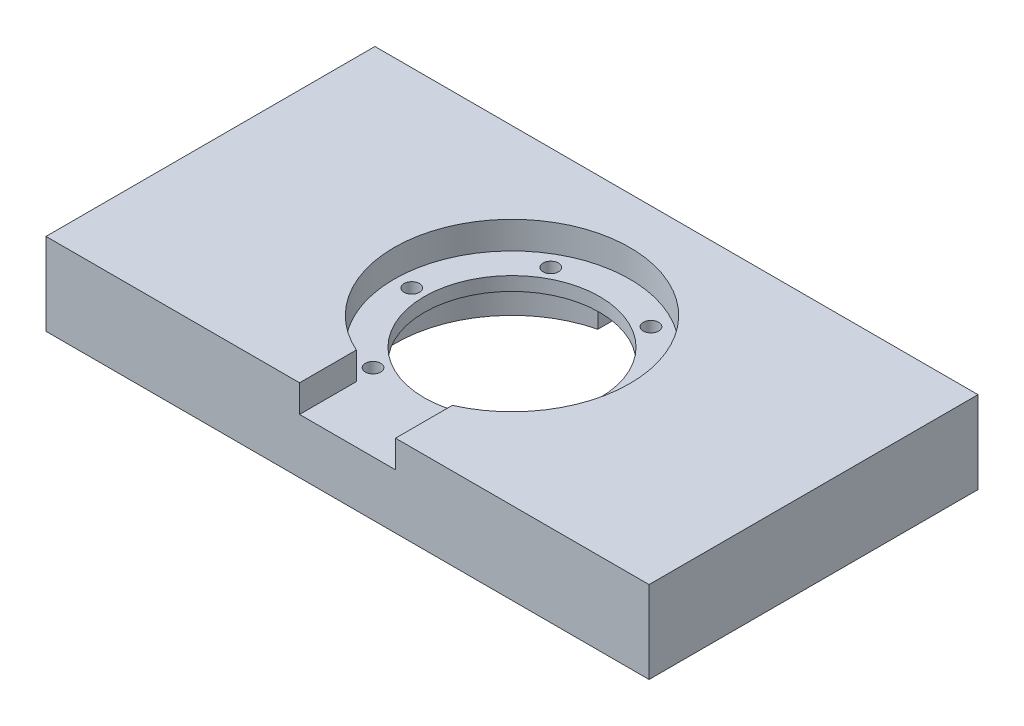
from build123d import *

# Parameters (mm, degrees)
SKETCH1_W               = 220
SKETCH1_H               = 120
SKETCH1_R               = 43
BOSS_EXTRUDE1_DEPTH     = 10
SKETCH2_W               = 220
SKETCH2_H               = 120
SKETCH2_R               = 2.8
BOSS_EXTRUDE2_DEPTH     = 20
CUT_EXTRUDE1_REACH      = 166.012
CUT_EXTRUDE1_END_RADIUS = 43
SKETCH3_W               = 35
SKETCH3_H               = 10
SKETCH4_R               = 32
CUT_EXTRUDE2_DEPTH      = 127.885775404
CUT_EXTRUDE3_REACH      = 166.012
CUT_EXTRUDE3_END_RADIUS = 32
SKETCH5_W               = 20
SKETCH5_H               = 10
SKETCH6_R               = 42.5
CUT_EXTRUDE4_DEPTH      = 15


with BuildPart() as part:
    # Sketch1 → Boss-Extrude1 (new body)
    with BuildSketch(Plane(origin=(0, 0, 0), x_dir=(1, 0, 0), z_dir=(0, 1, 0))):
        Rectangle(SKETCH1_W, SKETCH1_H)
        with Locations(Location((0, 0, 0), (0, 0, 270))):
            Circle(SKETCH1_R, mode=Mode.SUBTRACT)
    extrude(amount=BOSS_EXTRUDE1_DEPTH)

    # Sketch2 → Boss-Extrude2 (add)
    with BuildSketch(Plane.XZ):
        Rectangle(SKETCH2_W, SKETCH2_H)
        with Locations(Location((18.122136771, 32.25814872, 0), (0, 0, 270))):
            Circle(SKETCH2_R, mode=Mode.SUBTRACT)
        with Locations(Location((36.997444656, 0.434843546, 0), (0, 0, 270))):
            Circle(SKETCH2_R, mode=Mode.SUBTRACT)
        with Locations(Location((18.875307886, -31.823305174, 0), (0, 0, 270))):
            Circle(SKETCH2_R, mode=Mode.SUBTRACT)
        with Locations(Location((-18.122136771, -32.25814872, 0), (0, 0, 270))):
            Circle(SKETCH2_R, mode=Mode.SUBTRACT)
        with Locations(Location((-36.997444656, -0.434843546, 0), (0, 0, 270))):
            Circle(SKETCH2_R, mode=Mode.SUBTRACT)
        with Locations(Location((-18.875307886, 31.823305174, 0), (0, 0, 270))):
            Circle(SKETCH2_R, mode=Mode.SUBTRACT)
    extrude(amount=BOSS_EXTRUDE2_DEPTH)

    # Cut-Extrude1: up to this cylinder (the profile starts outside it)
    cut_extrude1_end = Plane(origin=(0, 5, 0), z_dir=(0, -1, 0)) * Cylinder(CUT_EXTRUDE1_END_RADIUS, 419.024, mode=Mode.PRIVATE)
    # Sketch3 → Cut-Extrude1 (cut, up to the surface)
    with BuildSketch(Plane.XY.offset(60), mode=Mode.PRIVATE) as cut_extrude1_sk1:
        with Locations((0, 5)):
            Rectangle(SKETCH3_W, SKETCH3_H)
    cut_extrude1_tool1 = extrude(cut_extrude1_sk1.sketch, amount=-CUT_EXTRUDE1_REACH, mode=Mode.PRIVATE) - cut_extrude1_end
    add(cut_extrude1_tool1.solids().sort_by_distance((0, 5, 60))[0], mode=Mode.SUBTRACT)

    # Sketch4 → Cut-Extrude2 (cut, through all)
    with BuildSketch(Plane(origin=(0, 0, 0), x_dir=(1, 0, 0), z_dir=(0, 1, 0))):
        with Locations(Location((0, 0, 0), (0, 0, 270))):
            Circle(SKETCH4_R)
    extrude(amount=-CUT_EXTRUDE2_DEPTH, mode=Mode.SUBTRACT)

    # Cut-Extrude3: up to this cylinder (the profile starts outside it)
    cut_extrude3_end = Plane(origin=(0, -15, 0), z_dir=(0, 1, 0)) * Cylinder(CUT_EXTRUDE3_END_RADIUS, 397.024, mode=Mode.PRIVATE)
    # Sketch5 → Cut-Extrude3 (cut, up to the surface)
    with BuildSketch(Plane(origin=(0, 0, -60), x_dir=(-1, 0, 0), z_dir=(0, 0, -1)), mode=Mode.PRIVATE) as cut_extrude3_sk1:
        with Locations((0, -15)):
            Rectangle(SKETCH5_W, SKETCH5_H)
    cut_extrude3_tool1 = extrude(cut_extrude3_sk1.sketch, amount=-CUT_EXTRUDE3_REACH, mode=Mode.PRIVATE) - cut_extrude3_end
    add(cut_extrude3_tool1.solids().sort_by_distance((0, -15, -60))[0], mode=Mode.SUBTRACT)

    # Sketch6 → Cut-Extrude4 (cut)
    with BuildSketch(Plane.XZ.offset(20)):
        with Locations(Location((0, 0, 0), (0, 0, 270))):
            Circle(SKETCH6_R)
    extrude(amount=-CUT_EXTRUDE4_DEPTH, mode=Mode.SUBTRACT)


solid = part.part
